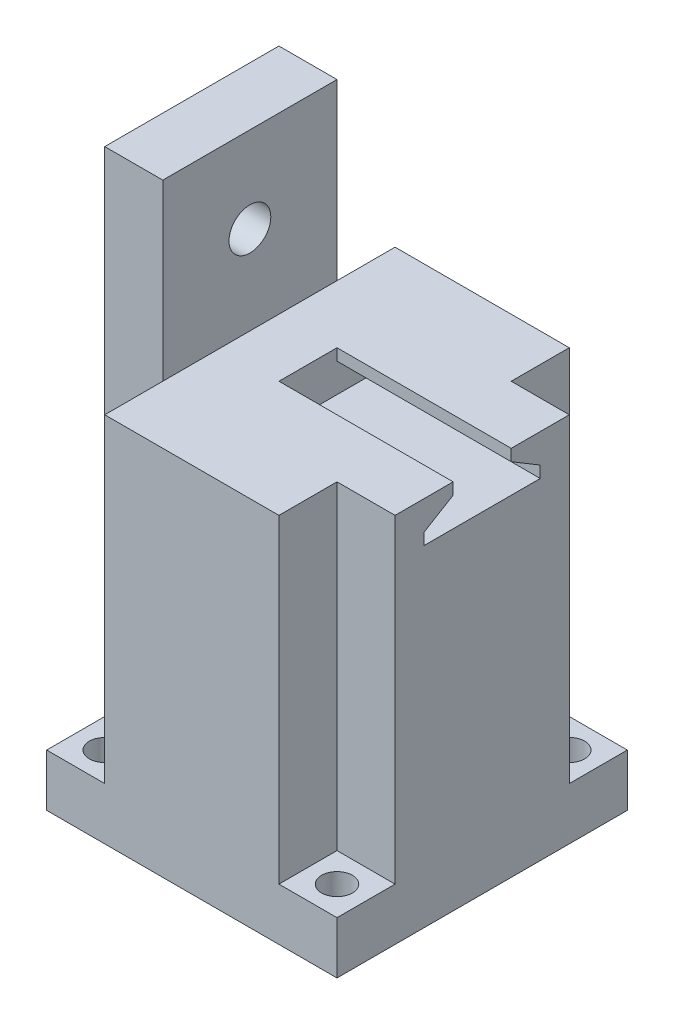
from build123d import *

# Parameters (mm, degrees)
SKETCH1_W           = 50
SKETCH1_H           = 50
BOSS_EXTRUDE1_DEPTH = 64
SKETCH2_W           = 10
SKETCH2_H           = 10
CUT_EXTRUDE1_DEPTH  = 55
CUT_EXTRUDE2_DEPTH  = 30
SKETCH4_W           = 10
SKETCH4_H           = 30
BOSS_EXTRUDE2_DEPTH = 30
SKETCH6_W           = 8
SKETCH6_H           = 25
SKETCH6_W_2         = 25
SKETCH6_H_2         = 8
CUT_EXTRUDE4_DEPTH  = 50
SKETCH7_R           = 3.6
CUT_EXTRUDE5_DEPTH  = 50
SKETCH8_R           = 2.65
CUT_EXTRUDE6_DEPTH  = 50


with BuildPart() as part:
    # Sketch1 → Boss-Extrude1 (new body)
    with BuildSketch(Plane(origin=(0, 0, 0), x_dir=(1, 0, 0), z_dir=(0, 1, 0))):
        Rectangle(SKETCH1_W, SKETCH1_H)
    extrude(amount=BOSS_EXTRUDE1_DEPTH)

    # Sketch2 → Cut-Extrude1 (cut)
    with BuildSketch(Plane(origin=(0, 64, 0), x_dir=(1, 0, 0), z_dir=(0, 1, 0))):
        with Locations((20, 20)):
            Rectangle(SKETCH2_W, SKETCH2_H)
        with Locations((-20, 20)):
            Rectangle(SKETCH2_W, SKETCH2_H)
        with Locations((20, -20)):
            Rectangle(SKETCH2_W, SKETCH2_H)
        with Locations((-20, -20)):
            Rectangle(SKETCH2_W, SKETCH2_H)
    extrude(amount=-CUT_EXTRUDE1_DEPTH, mode=Mode.SUBTRACT)

    # Sketch3 → Cut-Extrude2 (cut)
    with BuildSketch(Plane(origin=(25, 0, 0), x_dir=(0, 0, -1), z_dir=(1, 0, 0))):
        Polygon((-5, 64), (5, 64), (5, 62), (10, 59), (10, 57), (-10, 57), (-10, 59), (-5, 62), align=None)
    extrude(amount=-CUT_EXTRUDE2_DEPTH, mode=Mode.SUBTRACT)

    # Sketch4 → Boss-Extrude2 (add)
    with BuildSketch(Plane(origin=(0, 64, 0), x_dir=(1, 0, 0), z_dir=(0, 1, 0))):
        with Locations((-20, 0)):
            Rectangle(SKETCH4_W, SKETCH4_H)
    extrude(amount=BOSS_EXTRUDE2_DEPTH)

    # Sketch6 → Cut-Extrude4 (cut)
    with BuildSketch(Plane.XZ):
        with Locations((-16.5, 0)):
            Rectangle(SKETCH6_W, SKETCH6_H)
        with Locations((0, 16.5)):
            Rectangle(SKETCH6_W_2, SKETCH6_H_2)
        Rectangle(SKETCH6_W_2, SKETCH6_H)
        with Locations((16.5, 0)):
            Rectangle(SKETCH6_W, SKETCH6_H)
        with Locations((0, -16.5)):
            Rectangle(SKETCH6_W_2, SKETCH6_H_2)
    extrude(amount=-CUT_EXTRUDE4_DEPTH, mode=Mode.SUBTRACT)

    # Sketch7 → Cut-Extrude5 (cut)
    with BuildSketch(Plane(origin=(-15, 0, 0), x_dir=(0, 0, -1), z_dir=(1, 0, 0))):
        with Locations((0, 79.221173682)):
            Circle(SKETCH7_R)
    extrude(amount=-CUT_EXTRUDE5_DEPTH, mode=Mode.SUBTRACT)

    # Sketch8 → Cut-Extrude6 (cut)
    with BuildSketch(Plane(origin=(0, 9, 0), x_dir=(1, 0, 0), z_dir=(0, 1, 0))):
        with Locations(Location((20, -20, 0), (0, 0, 270))):
            Circle(SKETCH8_R)
        with Locations(Location((-20, -20, 0), (0, 0, 270))):
            Circle(SKETCH8_R)
        with Locations(Location((-20, 20, 0), (0, 0, 270))):
            Circle(SKETCH8_R)
        with Locations(Location((20, 20, 0), (0, 0, 270))):
            Circle(SKETCH8_R)
    extrude(amount=-CUT_EXTRUDE6_DEPTH, mode=Mode.SUBTRACT)


solid = part.part
